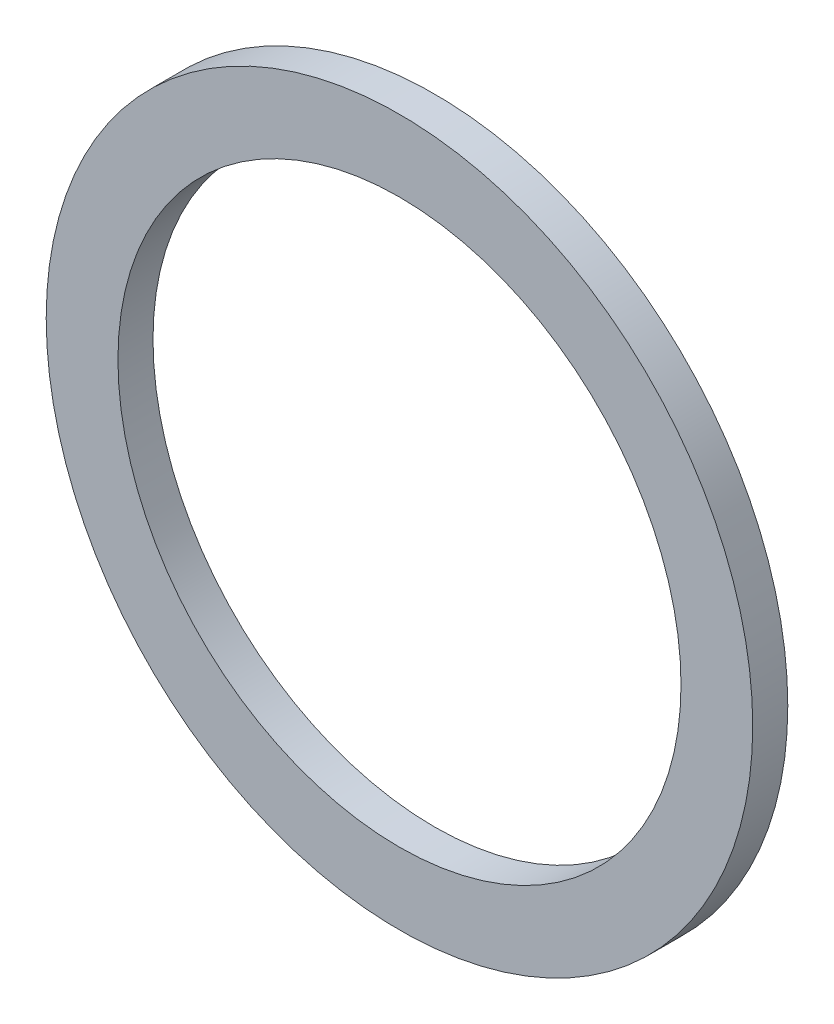
from build123d import *

# Parameters (mm, degrees)
SKETCH1_R           = 32.75
SKETCH1_R_2         = 26.1
BOSS_EXTRUDE1_DEPTH = 3.25


with BuildPart() as part:
    # Sketch1 → Boss-Extrude1 (new body)
    with BuildSketch(Plane.XY):
        with Locations(Location((0, 0, 0), (0, 0, 180))):
            Circle(SKETCH1_R)
        with Locations(Location((0, 0, 0), (0, 0, 180))):
            Circle(SKETCH1_R_2, mode=Mode.SUBTRACT)
    extrude(amount=BOSS_EXTRUDE1_DEPTH)


solid = part.part
